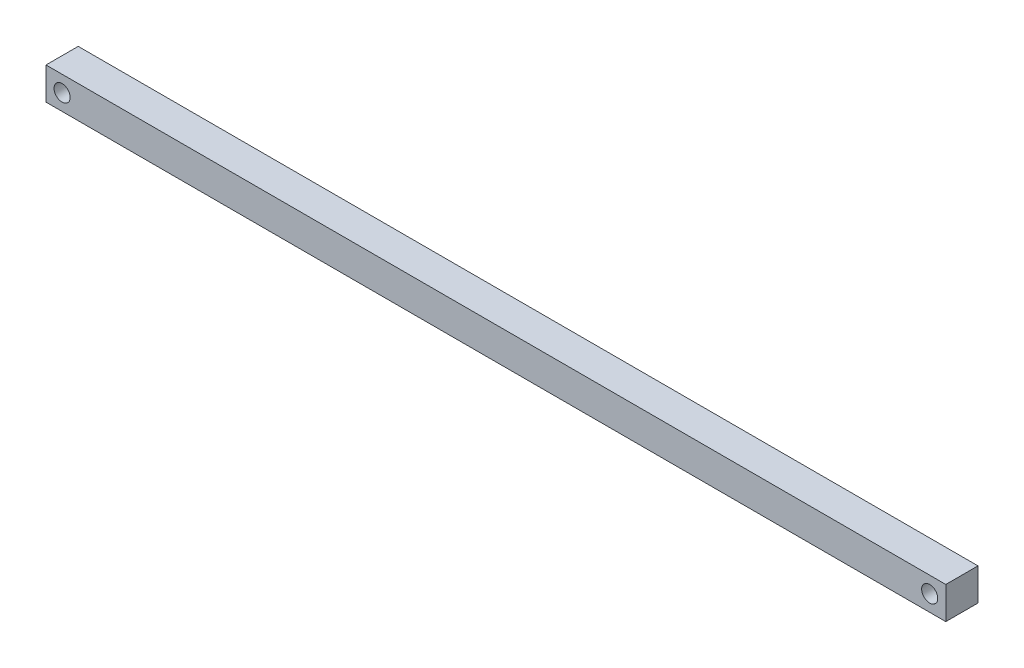
from build123d import *

# Parameters (mm, degrees)
SKETCH1_W           = 838
SKETCH1_H           = 30
SKETCH1_R           = 7.5
BOSS_EXTRUDE1_DEPTH = 15


with BuildPart() as part:
    # Sketch1 → Boss-Extrude1 (new, symmetric)
    with BuildSketch(Plane.XY):
        Rectangle(SKETCH1_W, SKETCH1_H)
        with Locations((-404, 0)):
            Circle(SKETCH1_R, mode=Mode.SUBTRACT)
        with Locations((404, 0)):
            Circle(SKETCH1_R, mode=Mode.SUBTRACT)
    extrude(amount=BOSS_EXTRUDE1_DEPTH, both=True)


solid = part.part
